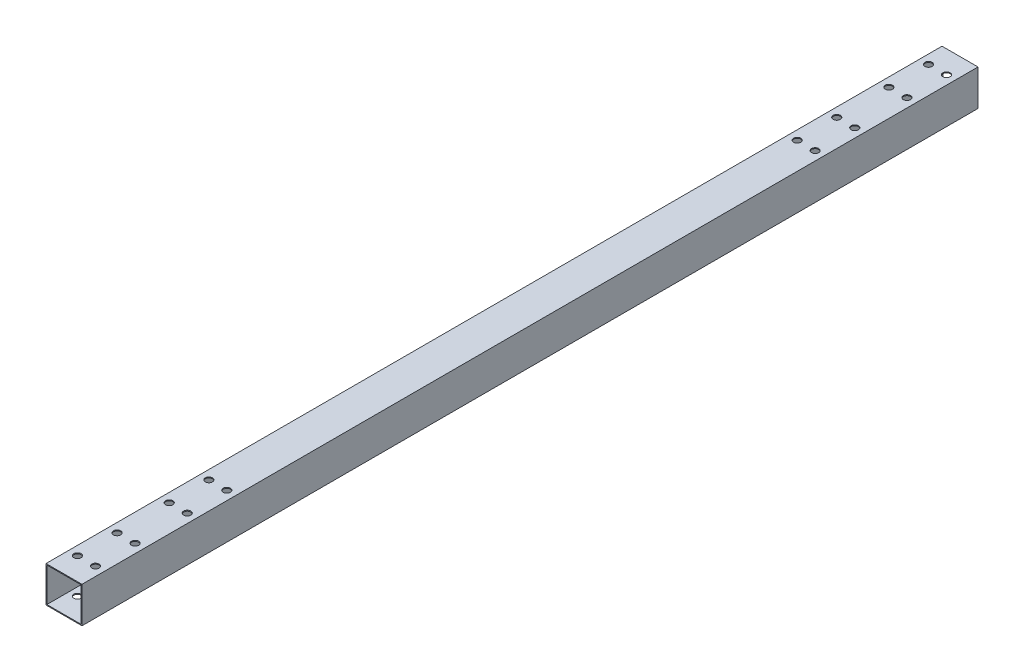
from build123d import *

# Parameters (mm, degrees)
SKETCH_1_W          = 20
SKETCH_1_H          = 20
SKETCH_1_W_2        = 19
SKETCH_1_H_2        = 19
EXTRUDE_1_DEPTH     = 498
SKETCH_2_R          = 2
CUT_EXTRUDE_1_DEPTH = 20


with BuildPart() as part:
    # 草图1 → 凸台-拉伸1 (new body)
    with BuildSketch(Plane.XY):
        Rectangle(SKETCH_1_W, SKETCH_1_H)
        Rectangle(SKETCH_1_W_2, SKETCH_1_H_2, mode=Mode.SUBTRACT)
    extrude(amount=EXTRUDE_1_DEPTH)

    # 草图2 → 切除-拉伸1 (cut)
    with BuildSketch(Plane(origin=(0, 10, 0), x_dir=(1, 0, 0), z_dir=(0, 1, 0))):
        with Locations(Location((-5, -12.5, 0), (0, 0, 270))):
            Circle(SKETCH_2_R)
        with Locations(Location((-5, -34.5, 0), (0, 0, 270))):
            Circle(SKETCH_2_R)
        with Locations(Location((-5, -85.5, 0), (0, 0, 270))):
            Circle(SKETCH_2_R)
        with Locations(Location((-5, -63.5, 0), (0, 0, 270))):
            Circle(SKETCH_2_R)
        with Locations(Location((-5, -434.5, 0), (0, 0, 270))):
            Circle(SKETCH_2_R)
        with Locations(Location((-5, -412.5, 0), (0, 0, 270))):
            Circle(SKETCH_2_R)
        with Locations(Location((-5, -463.5, 0), (0, 0, 270))):
            Circle(SKETCH_2_R)
        with Locations(Location((-5, -485.5, 0), (0, 0, 270))):
            Circle(SKETCH_2_R)
        with Locations(Location((5, -485.5, 0), (0, 0, 270))):
            Circle(SKETCH_2_R)
        with Locations(Location((5, -463.5, 0), (0, 0, 270))):
            Circle(SKETCH_2_R)
        with Locations(Location((5, -434.5, 0), (0, 0, 270))):
            Circle(SKETCH_2_R)
        with Locations(Location((5, -412.5, 0), (0, 0, 270))):
            Circle(SKETCH_2_R)
        with Locations(Location((5, -85.5, 0), (0, 0, 270))):
            Circle(SKETCH_2_R)
        with Locations(Location((5, -63.5, 0), (0, 0, 270))):
            Circle(SKETCH_2_R)
        with Locations(Location((5, -34.5, 0), (0, 0, 270))):
            Circle(SKETCH_2_R)
        with Locations(Location((5, -12.5, 0), (0, 0, 270))):
            Circle(SKETCH_2_R)
    extrude(amount=-CUT_EXTRUDE_1_DEPTH, mode=Mode.SUBTRACT)


solid = part.part
